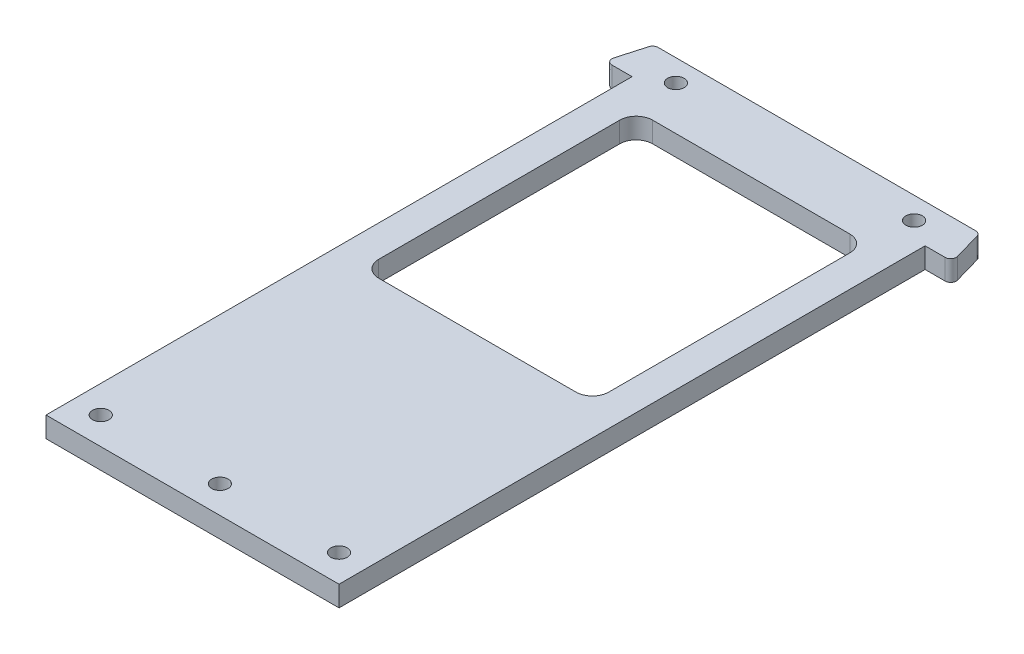
from build123d import *

# Parameters (mm, degrees)
SKETCH1_W           = 53.5
SKETCH1_H           = 114
SKETCH1_R           = 1.5
SKETCH1_W_2         = 42
SKETCH1_H_2         = 50
BOSS_EXTRUDE1_DEPTH = 3.75
FILLET1_R           = 3
BOSS_EXTRUDE2_DEPTH = 3.75
FILLET2_R           = 1


with BuildPart() as part:
    # Sketch1 → Boss-Extrude1 (new body)
    with BuildSketch(Plane(origin=(0, 0, 0), x_dir=(1, 0, 0), z_dir=(0, 1, 0))):
        with Locations((26.75, 57)):
            Rectangle(SKETCH1_W, SKETCH1_H)
        with Locations(Location((5, 5, 0), (0, 0, 270))):
            Circle(SKETCH1_R, mode=Mode.SUBTRACT)
        with Locations(Location((48.5, 5, 0), (0, 0, 270))):
            Circle(SKETCH1_R, mode=Mode.SUBTRACT)
        with Locations(Location((26.75, 5, 0), (0, 0, 270))):
            Circle(SKETCH1_R, mode=Mode.SUBTRACT)
        with Locations(Location((5, 110, 0), (0, 0, 270))):
            Circle(SKETCH1_R, mode=Mode.SUBTRACT)
        with Locations(Location((48.5, 110, 0), (0, 0, 270))):
            Circle(SKETCH1_R, mode=Mode.SUBTRACT)
        with Locations((26.75, 77)):
            Rectangle(SKETCH1_W_2, SKETCH1_H_2, mode=Mode.SUBTRACT)
    extrude(amount=BOSS_EXTRUDE1_DEPTH)

    # Fillet1
    fillet1_edges = [part.edges().sort_by_distance(p)[0] for p in [
        (5.75, 1.875, -102),
        (5.75, 1.875, -52),
        (47.75, 1.875, -52),
        (47.75, 1.875, -102),
    ]]
    fillet(fillet1_edges, radius=FILLET1_R)

    # Sketch2 → Boss-Extrude2 (add)
    with BuildSketch(Plane(origin=(0, 3.75, 0), x_dir=(1, 0, 0), z_dir=(0, 1, 0))):
        Polygon((0, 114), (-3, 114), (-5, 107), (0, 107), align=None)
        Polygon((53.5, 114), (56.5, 114), (58.5, 107), (53.5, 107), align=None)
    extrude(amount=-BOSS_EXTRUDE2_DEPTH)

    # Fillet2
    fillet2_edges = [part.edges().sort_by_distance(p)[0] for p in [
        (56.5, 1.875, -114),
        (58.5, 1.875, -107),
        (-5, 1.875, -107),
        (-3, 1.875, -114),
    ]]
    fillet(fillet2_edges, radius=FILLET2_R)


solid = part.part
